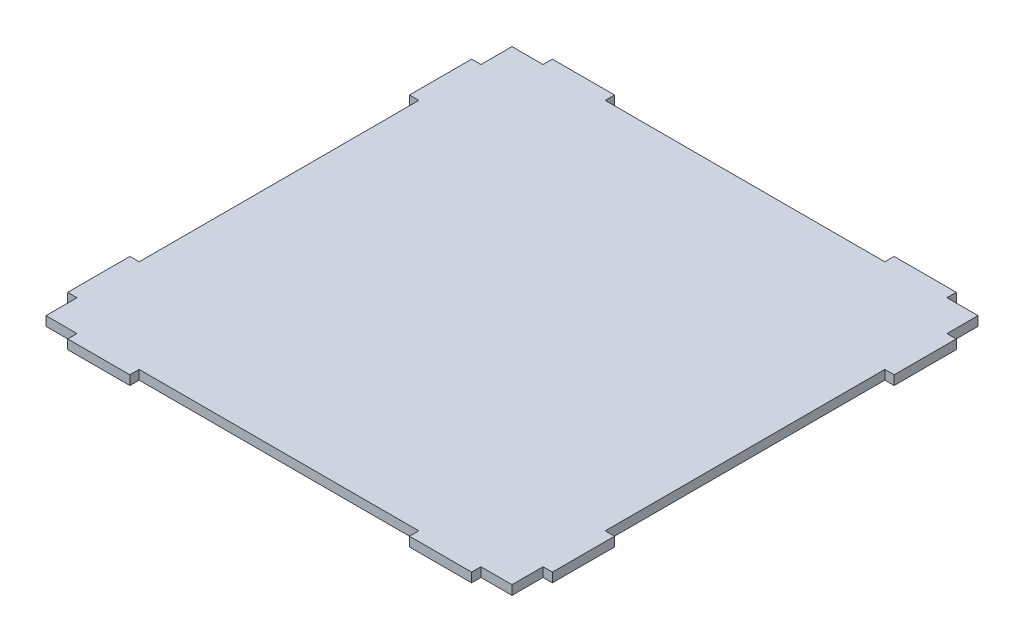
from build123d import *

# Parameters (mm, degrees)
SKETCH1_W            = 150
SKETCH1_H            = 150
BOSS_EXTRUDE9_DEPTH  = 3
SKETCH8_W            = 20
SKETCH8_H            = 3
BOSS_EXTRUDE10_DEPTH = 3
SKETCH9_W            = 20
SKETCH9_H            = 3
BOSS_EXTRUDE11_DEPTH = 3
SKETCH10_W           = 20
SKETCH10_H           = 3
BOSS_EXTRUDE12_DEPTH = 3
SKETCH11_W           = 20
SKETCH11_H           = 3
BOSS_EXTRUDE13_DEPTH = 3
SKETCH13_W           = 20
SKETCH13_H           = 3
BOSS_EXTRUDE14_DEPTH = 3
SKETCH14_W           = 20
SKETCH14_H           = 3
BOSS_EXTRUDE15_DEPTH = 3
SKETCH15_W           = 20
SKETCH15_H           = 3
BOSS_EXTRUDE16_DEPTH = 3
SKETCH16_W           = 20
SKETCH16_H           = 3
BOSS_EXTRUDE17_DEPTH = 3


with BuildPart() as part:
    # Sketch1 → Boss-Extrude9 (new body)
    with BuildSketch(Plane(origin=(0, 0, 0), x_dir=(1, 0, 0), z_dir=(0, 1, 0))):
        with Locations((75, 75)):
            Rectangle(SKETCH1_W, SKETCH1_H)
    extrude(amount=BOSS_EXTRUDE9_DEPTH)

    # Sketch8 → Boss-Extrude10 (add)
    with BuildSketch(Plane.ZY):
        with Locations((-20, 1.5)):
            Rectangle(SKETCH8_W, SKETCH8_H)
    extrude(amount=BOSS_EXTRUDE10_DEPTH)

    # Sketch9 → Boss-Extrude11 (add)
    with BuildSketch(Plane.XY):
        with Locations((20, 1.5)):
            Rectangle(SKETCH9_W, SKETCH9_H)
    extrude(amount=BOSS_EXTRUDE11_DEPTH)

    # Sketch10 → Boss-Extrude12 (add)
    with BuildSketch(Plane.XY):
        with Locations((130, 1.5)):
            Rectangle(SKETCH10_W, SKETCH10_H)
    extrude(amount=BOSS_EXTRUDE12_DEPTH)

    # Sketch11 → Boss-Extrude13 (add)
    with BuildSketch(Plane(origin=(150, 0, 0), x_dir=(0, 0, -1), z_dir=(1, 0, 0))):
        with Locations((20, 1.5)):
            Rectangle(SKETCH11_W, SKETCH11_H)
    extrude(amount=BOSS_EXTRUDE13_DEPTH)

    # Sketch13 → Boss-Extrude14 (add)
    with BuildSketch(Plane(origin=(150, 0, 0), x_dir=(0, 0, -1), z_dir=(1, 0, 0))):
        with Locations((130, 1.5)):
            Rectangle(SKETCH13_W, SKETCH13_H)
    extrude(amount=BOSS_EXTRUDE14_DEPTH)

    # Sketch14 → Boss-Extrude15 (add)
    with BuildSketch(Plane(origin=(0, 0, -150), x_dir=(-1, 0, 0), z_dir=(0, 0, -1))):
        with Locations((-130, 1.5)):
            Rectangle(SKETCH14_W, SKETCH14_H)
    extrude(amount=BOSS_EXTRUDE15_DEPTH)

    # Sketch15 → Boss-Extrude16 (add)
    with BuildSketch(Plane(origin=(0, 0, -150), x_dir=(-1, 0, 0), z_dir=(0, 0, -1))):
        with Locations((-20, 1.5)):
            Rectangle(SKETCH15_W, SKETCH15_H)
    extrude(amount=BOSS_EXTRUDE16_DEPTH)

    # Sketch16 → Boss-Extrude17 (add)
    with BuildSketch(Plane.ZY):
        with Locations((-130, 1.5)):
            Rectangle(SKETCH16_W, SKETCH16_H)
    extrude(amount=BOSS_EXTRUDE17_DEPTH)


solid = part.part
